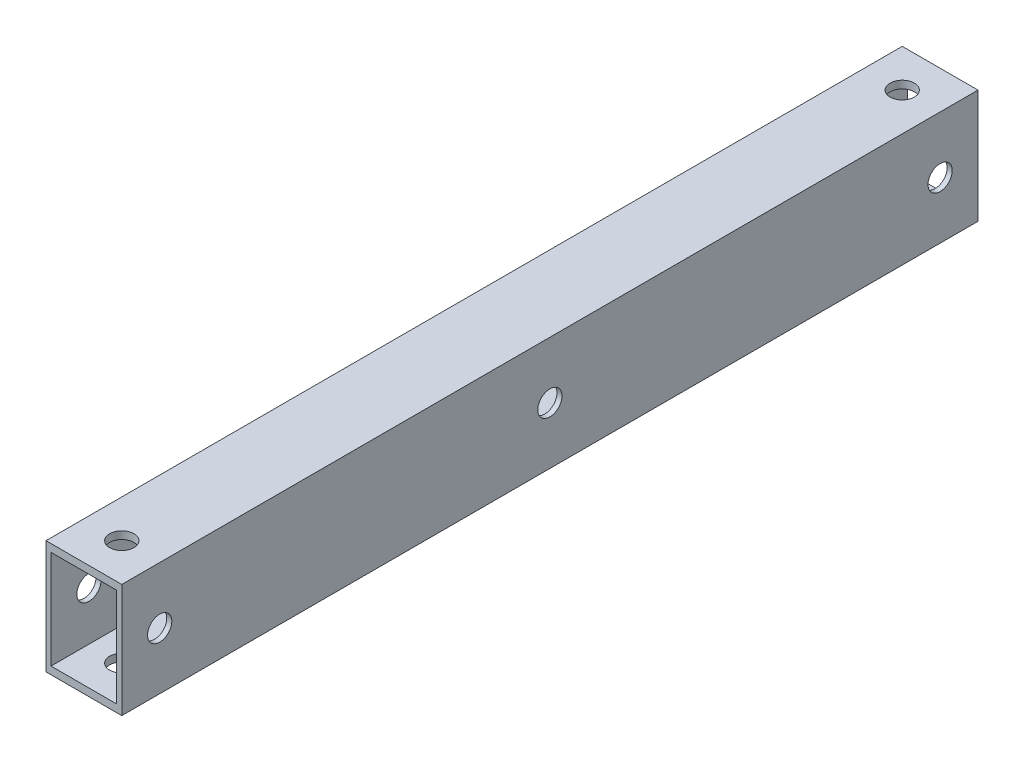
from build123d import *

# Parameters (mm, degrees)
SKETCH_1_W          = 10
SKETCH_1_H          = 15
SKETCH_1_W_2        = 8.666666666
SKETCH_1_H_2        = 13
EXTRUDE_1_DEPTH     = 56.5
SKETCH_2_R          = 1.6
CUT_EXTRUDE_1_DEPTH = 58.866225037
SKETCH_3_R          = 1.6
CUT_EXTRUDE_2_DEPTH = 59.67069115
SKETCH_4_R          = 1.6
CUT_EXTRUDE_3_DEPTH = 58.866225037


with BuildPart() as part:
    # ｽｹｯﾁ1 → ﾎﾞｽ - 押し出し1 (new body)
    with BuildSketch(Plane.XY):
        Rectangle(SKETCH_1_W, SKETCH_1_H)
        Rectangle(SKETCH_1_W_2, SKETCH_1_H_2, mode=Mode.SUBTRACT)
    extrude_1 = extrude(amount=EXTRUDE_1_DEPTH)

    # ｽｹｯﾁ2 → ｶｯﾄ - 押し出し1 (cut, through all)
    with BuildSketch(Plane(origin=(5, 0, 0), x_dir=(0, 0, -1), z_dir=(1, 0, 0))):
        Circle(SKETCH_2_R)
    cut_extrude_1 = extrude(amount=-CUT_EXTRUDE_1_DEPTH, mode=Mode.SUBTRACT)

    # ｽｹｯﾁ3 → ｶｯﾄ - 押し出し2 (cut, through all)
    with BuildSketch(Plane(origin=(0, 7.5, 0), x_dir=(1, 0, 0), z_dir=(0, 1, 0))):
        with Locations(Location((0, -51.5, 0), (0, 0, 270))):
            Circle(SKETCH_3_R)
    cut_extrude_2 = extrude(amount=-CUT_EXTRUDE_2_DEPTH, mode=Mode.SUBTRACT)

    # ｽｹｯﾁ4 → ｶｯﾄ - 押し出し3 (cut, through all)
    with BuildSketch(Plane.ZY.offset(5)):
        with Locations((51.5, 0)):
            Circle(SKETCH_4_R)
    cut_extrude_3 = extrude(amount=-CUT_EXTRUDE_3_DEPTH, mode=Mode.SUBTRACT)

    # ﾐﾗｰ1: ﾎﾞｽ - 押し出し1, ｶｯﾄ - 押し出し1, ｶｯﾄ - 押し出し2, ｶｯﾄ - 押し出し3 across plane
    add(extrude_1.mirror(Plane(origin=(0, 0, 0), x_dir=(1, 0, 0), z_dir=(0, 0, -1))))
    add(cut_extrude_1.mirror(Plane(origin=(0, 0, 0), x_dir=(1, 0, 0), z_dir=(0, 0, -1))), mode=Mode.SUBTRACT)
    add(cut_extrude_2.mirror(Plane(origin=(0, 0, 0), x_dir=(1, 0, 0), z_dir=(0, 0, -1))), mode=Mode.SUBTRACT)
    add(cut_extrude_3.mirror(Plane(origin=(0, 0, 0), x_dir=(1, 0, 0), z_dir=(0, 0, -1))), mode=Mode.SUBTRACT)


solid = part.part
